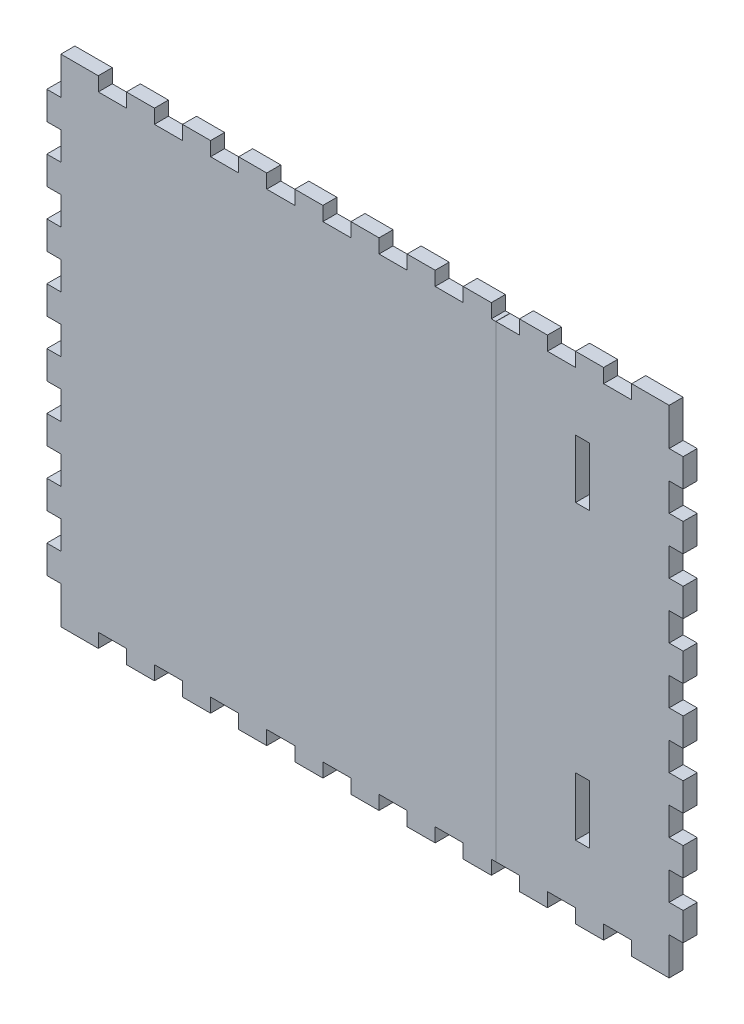
from build123d import *

# Parameters (mm, degrees)
BOSS_EXTRUDE1_DEPTH = 6
SKETCH2_W           = 0.1
SKETCH2_H           = 265.514483505
SKETCH2_W_2         = 6
SKETCH2_H_2         = 25
CUT_EXTRUDE1_DEPTH  = 6


with BuildPart() as part:
    # Model → Boss-Extrude1 (new body)
    with BuildSketch(Plane.XY):
        Polygon((221, 215), (221, 199), (215, 199), (215, 187), (221, 187), (221, 175), (215, 175), (215, 163), (221, 163), (221, 151), (215, 151), (215, 139), (221, 139), (221, 127), (215, 127), (215, 115), (221, 115), (221, 103), (215, 103), (215, 91), (221, 91), (221, 79), (215, 79), (215, 67), (221, 67), (221, 55), (215, 55), (215, 43), (221, 43), (221, 31), (215, 31), (215, 19), (221, 19), (221, 3), (237, 3), (237, 9), (249, 9), (249, 3), (261, 3), (261, 9), (273, 9), (273, 3), (285, 3), (285, 9), (297, 9), (297, 3), (309, 3), (309, 9), (321, 9), (321, 3), (333, 3), (333, 9), (345, 9), (345, 3), (357, 3), (357, 9), (369, 9), (369, 3), (381, 3), (381, 9), (393, 9), (393, 3), (405, 3), (405, 9), (417, 9), (417, 3), (429, 3), (429, 9), (441, 9), (441, 3), (453, 3), (453, 9), (465, 9), (465, 3), (477, 3), (481, 3), (481, 19), (487, 19), (487, 31), (481, 31), (481, 43), (487, 43), (487, 55), (481, 55), (481, 67), (487, 67), (487, 79), (481, 79), (481, 91), (487, 91), (487, 103), (481, 103), (481, 115), (487, 115), (487, 127), (481, 127), (481, 139), (487, 139), (487, 151), (481, 151), (481, 163), (487, 163), (487, 175), (481, 175), (481, 187), (487, 187), (487, 199), (481, 199), (481, 215), (465, 215), (465, 209), (453, 209), (453, 215), (441, 215), (441, 209), (429, 209), (429, 215), (417, 215), (417, 209), (405, 209), (405, 215), (393, 215), (393, 209), (381, 209), (381, 215), (369, 215), (369, 209), (357, 209), (357, 215), (345, 215), (345, 209), (333, 209), (333, 215), (321, 215), (321, 209), (309, 209), (309, 215), (297, 215), (297, 209), (285, 209), (285, 215), (273, 215), (273, 209), (261, 209), (261, 215), (249, 215), (249, 209), (237, 209), (237, 215), (225, 215), align=None)
    extrude(amount=BOSS_EXTRUDE1_DEPTH)

    # Sketch2 → Cut-Extrude1 (cut)
    with BuildSketch(Plane.XY.offset(6)):
        with Locations((406.95, 104.310206134)):
            Rectangle(SKETCH2_W, SKETCH2_H)
        with Locations((444, 171.5)):
            Rectangle(SKETCH2_W_2, SKETCH2_H_2)
        with Locations((444, 46.5)):
            Rectangle(SKETCH2_W_2, SKETCH2_H_2)
    extrude(amount=-CUT_EXTRUDE1_DEPTH, mode=Mode.SUBTRACT)


with BuildPart() as cut_extrude1_piece_1:
    # of the separate pieces the step leaves, piece 1, a body of its own (cut_extrude1_pieces)
    add(part.part.solids().sort_by_distance((221, 215, 0))[0])


with BuildPart() as cut_extrude1_piece_2:
    # of the separate pieces the step leaves, piece 2, a body of its own (cut_extrude1_pieces)
    add(part.part.solids().sort_by_distance((417, 209, 0))[0])


solid = Compound([cut_extrude1_piece_1.part, cut_extrude1_piece_2.part])
